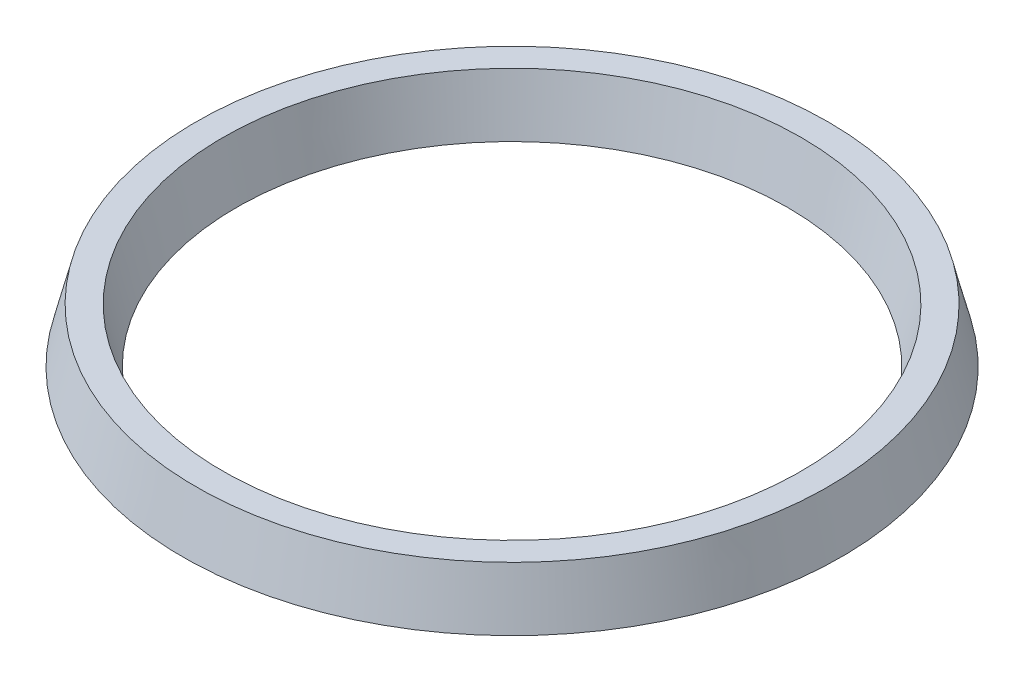
from build123d import *


with BuildPart() as part:
    # Sketch1 → Revolve1 (revolve)
    with BuildSketch(Plane.XY, mode=Mode.PRIVATE) as revolve1_sk:
        with BuildLine():
            Line((3, 6), (-3, 6))
            Line((-3, 6), (-6, -6))
            Line((-6, -6), (-3, -6))
            Line((-3, -6), (-1.863803438, -1.45521375))
            ThreePointArc((-1.863803438, -1.45521375), (0, 0), (1.863803438, -1.45521375))
            Line((1.863803438, -1.45521375), (3, -6))
            Line((3, -6), (6, -6))
            Line((6, -6), (3, 6))
        make_face()
    revolve(revolve1_sk.sketch.rotate(Axis((-67.31, 0, 0), (0, 1, 0)), 90), axis=Axis((-67.31, 0, 0), (0, 1, 0)))


solid = part.part
